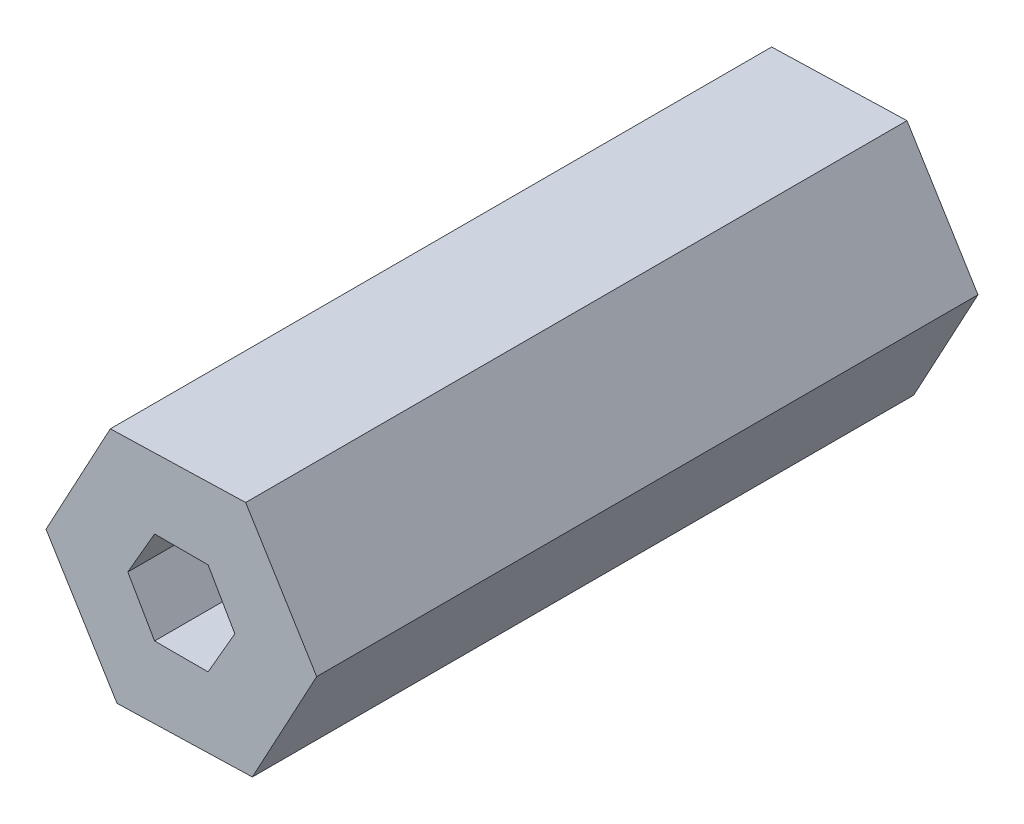
from build123d import *

# Parameters (mm, degrees)
BOSS_EXTRUDE2_DEPTH = 35.814


with BuildPart() as part:
    # Sketch4 → Boss-Extrude2 (new body)
    # profile 1 of 2: a face of its own
    with BuildSketch(Plane.XY):
        Polygon((-3.483559495, -6.4519878), (3.845805592, -6.242844919), (7.329365088, 0.209142882), (3.483559495, 6.4519878), (-3.845805592, 6.242844919), (-7.329365088, -0.209142882), align=None)
        Polygon((2.306514325, -3.995), (4.613028651, 0), (2.306514325, 3.995), (-2.306514325, 3.995), (-4.613028651, 0), (-2.306514325, -3.995), align=None, mode=Mode.SUBTRACT)
    # profile 2 of 2: a face of its own
    with BuildSketch(Plane.XY):
        Polygon((-2.306514325, -3.995), (2.306514325, -3.995), (4.613028651, 0), (2.306514325, 3.995), (-2.306514325, 3.995), (-4.613028651, 0), align=None)
        Polygon((1.449149176, -2.51), (2.898298351, 0), (1.449149176, 2.51), (-1.449149176, 2.51), (-2.898298351, 0), (-1.449149176, -2.51), align=None, mode=Mode.SUBTRACT)
    extrude(amount=BOSS_EXTRUDE2_DEPTH)


solid = part.part
